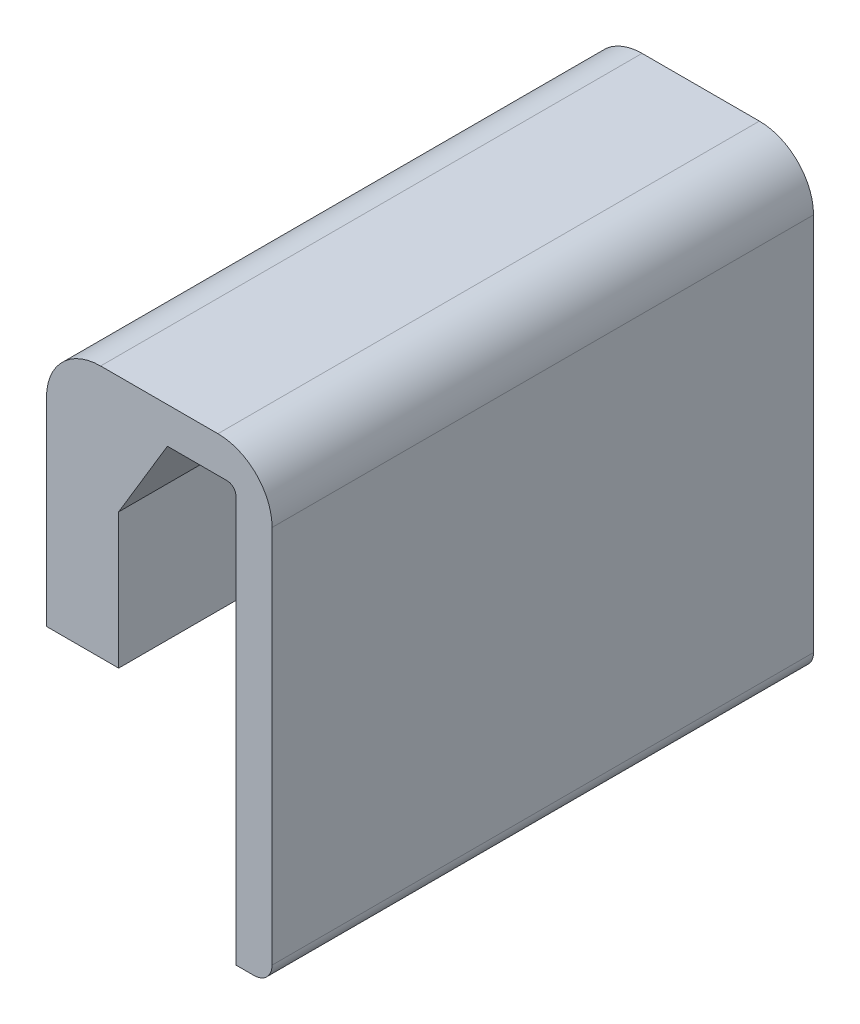
from build123d import *

# Parameters (mm, degrees)
BOSS_EXTRUDE1_DEPTH = 30
FILLET1_R           = 3
FILLET2_R           = 0.5
FILLET3_R           = 1
CUT_EXTRUDE1_DEPTH  = 10


with BuildPart() as part:
    # Sketch1 → Boss-Extrude1 (new body)
    with BuildSketch(Plane.XY):
        Polygon((0, 0), (0, 50), (12.5, 50), (12.5, 25), (10.5, 25), (10.5, 48), (6.7, 48), (4, 43.5), (4, 0), align=None)
    extrude(amount=BOSS_EXTRUDE1_DEPTH)

    # Fillet1
    fillet1_edges = [part.edges().sort_by_distance(p)[0] for p in [
        (0, 50, 15),
        (12.5, 50, 15),
    ]]
    fillet(fillet1_edges, radius=FILLET1_R)

    # Fillet2
    fillet2_edges = [part.edges().sort_by_distance(p)[0] for p in [
        (10.5, 48, 15),
    ]]
    fillet(fillet2_edges, radius=FILLET2_R)

    # Fillet3
    fillet3_edges = [part.edges().sort_by_distance(p)[0] for p in [
        (12.5, 25, 15),
    ]]
    fillet(fillet3_edges, radius=FILLET3_R)

    # Sketch2 → Cut-Extrude1 (cut)
    with BuildSketch(Plane.ZY):
        Polygon((10, 42), (20, 42), (18, 36), (30, 36), (30, 0), (0, 0), (0, 36), (12, 36), align=None)
    extrude(amount=-CUT_EXTRUDE1_DEPTH, mode=Mode.SUBTRACT)


solid = part.part
